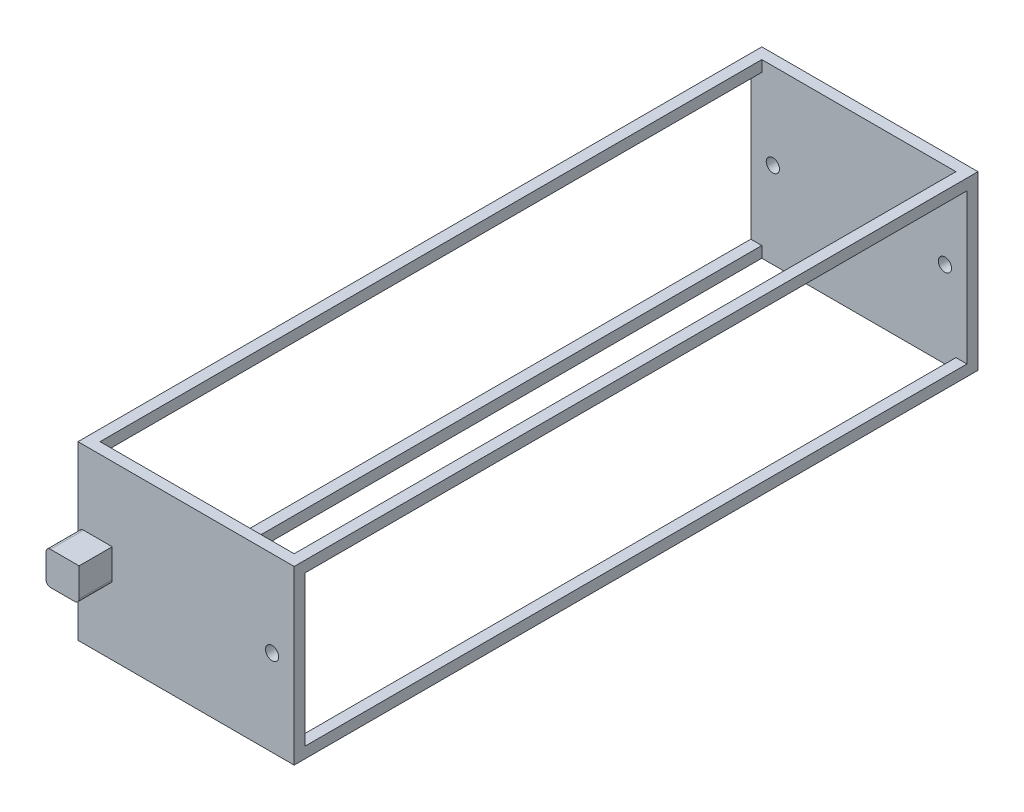
from build123d import *

# Parameters (mm, degrees)
SKETCH1_W           = 490
SKETCH1_H           = 390
BOSS_EXTRUDE1_DEPTH = 25
SKETCH2_W           = 25
SKETCH2_H           = 25
BOSS_EXTRUDE2_DEPTH = 1500
SKETCH3_W           = 490
SKETCH3_H           = 390
BOSS_EXTRUDE3_DEPTH = 25
SKETCH4_R           = 15
CUT_EXTRUDE1_DEPTH  = 1550
SKETCH5_R           = 13.709013017
BOSS_EXTRUDE4_DEPTH = 10
SKETCH6_W           = 75
SKETCH6_H           = 75
BOSS_EXTRUDE5_DEPTH = 75
FILLET1_R           = 10


with BuildPart() as part:
    # Sketch1 → Boss-Extrude1 (new body)
    with BuildSketch(Plane.XY):
        with Locations((225, -175)):
            Rectangle(SKETCH1_W, SKETCH1_H)
    extrude(amount=BOSS_EXTRUDE1_DEPTH)

    # Sketch2 → Boss-Extrude2 (add)
    with BuildSketch(Plane.XY.offset(25)):
        with Locations((-7.5, 7.5)):
            Rectangle(SKETCH2_W, SKETCH2_H)
        with Locations((457.5, 7.5)):
            Rectangle(SKETCH2_W, SKETCH2_H)
        with Locations((457.5, -357.5)):
            Rectangle(SKETCH2_W, SKETCH2_H)
        with Locations((-7.5, -357.5)):
            Rectangle(SKETCH2_W, SKETCH2_H)
    extrude(amount=BOSS_EXTRUDE2_DEPTH)

    # Sketch3 → Boss-Extrude3 (add)
    with BuildSketch(Plane.XY.offset(1525)):
        with Locations((225, -175)):
            Rectangle(SKETCH3_W, SKETCH3_H)
    extrude(amount=BOSS_EXTRUDE3_DEPTH)

    # Sketch4 → Cut-Extrude1 (cut)
    with BuildSketch(Plane.XY.offset(1550)):
        with Locations((420, -175)):
            Circle(SKETCH4_R)
        with Locations((30, -175)):
            Circle(SKETCH4_R)
    extrude(amount=-CUT_EXTRUDE1_DEPTH, mode=Mode.SUBTRACT)


with BuildPart() as body_2:
    # Sketch5 → Boss-Extrude4 (new body)
    with BuildSketch(Plane.XY.offset(1550)):
        with Locations((30, -175)):
            Circle(SKETCH5_R)
    extrude(amount=BOSS_EXTRUDE4_DEPTH)

    # Sketch6 → Boss-Extrude5 (add)
    with BuildSketch(Plane.XY.offset(1560)):
        with Locations((30, -175)):
            Rectangle(SKETCH6_W, SKETCH6_H)
    extrude(amount=BOSS_EXTRUDE5_DEPTH)

    # Fillet1
    fillet1_edges = [body_2.edges().sort_by_distance(p)[0] for p in [
        (67.5, -212.5, 1597.5),
        (-7.5, -137.5, 1597.5),
        (-7.5, -212.5, 1597.5),
    ]]
    fillet(fillet1_edges, radius=FILLET1_R)


solid = Compound([part.part, body_2.part])
